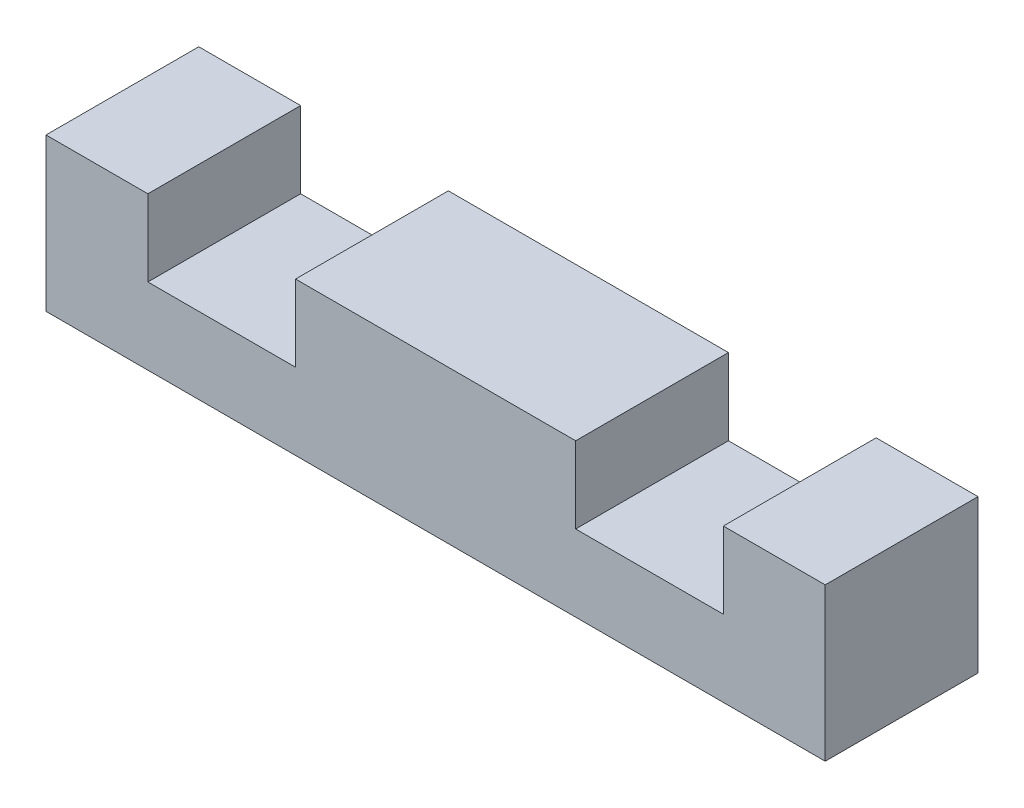
from build123d import *

# Parameters (mm, degrees)
BOSS_EXTRU_1_DEPTH = 6


with BuildPart() as part:
    # Esquisse1 → Boss.-Extru.1 (new body)
    with BuildSketch(Plane.XY):
        Polygon((0, 0), (0, 6), (4, 6), (4, 3), (9.8, 3), (9.8, 6), (20.8, 6), (20.8, 3), (26.6, 3), (26.6, 6), (30.6, 6), (30.6, 0), align=None)
    extrude(amount=BOSS_EXTRU_1_DEPTH)


solid = part.part
